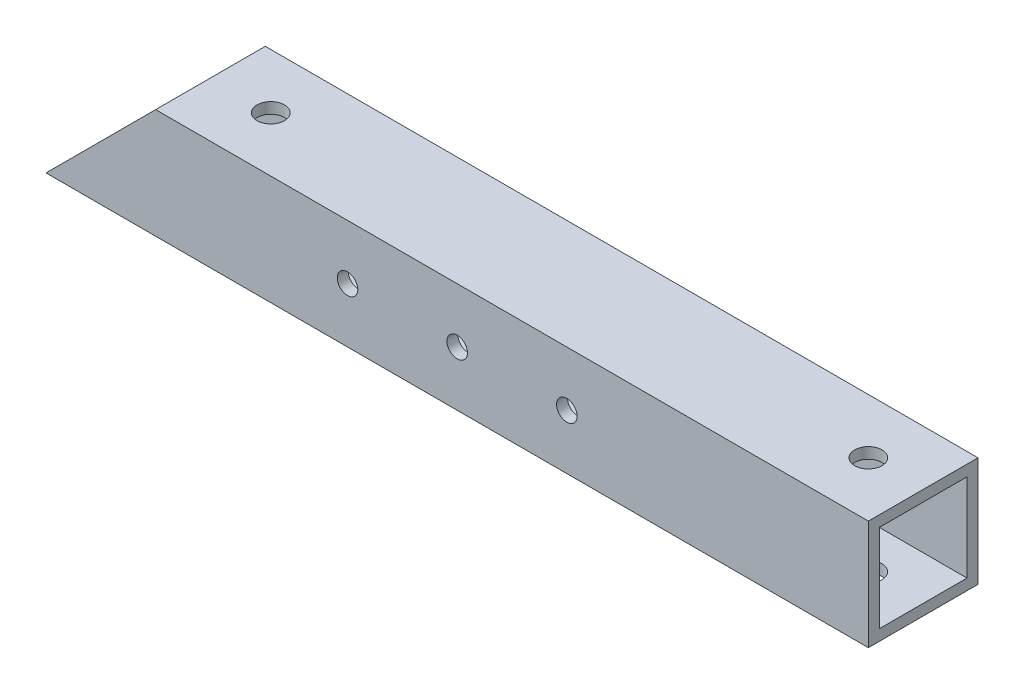
from build123d import *

# Parameters (mm, degrees)
SKETCH1_W           = 25.4
SKETCH1_H           = 25.4
SKETCH1_W_2         = 20.32
SKETCH1_H_2         = 20.32
BOSS_EXTRUDE1_DEPTH = 190.5
CUT_EXTRUDE1_DEPTH  = 193.605036279
SKETCH3_R           = 3.175
CUT_EXTRUDE2_DEPTH  = 193.605036279
SKETCH4_R           = 2.38125
CUT_EXTRUDE3_DEPTH  = 193.605036279


with BuildPart() as part:
    # Sketch1 → Boss-Extrude1 (new body)
    with BuildSketch(Plane(origin=(0, 0, 0), x_dir=(0, 0, -1), z_dir=(1, 0, 0))):
        Rectangle(SKETCH1_W, SKETCH1_H)
        Rectangle(SKETCH1_W_2, SKETCH1_H_2, mode=Mode.SUBTRACT)
    extrude(amount=BOSS_EXTRUDE1_DEPTH)

    # Sketch2 → Cut-Extrude1 (cut, through all)
    with BuildSketch(Plane.XY.offset(12.7)):
        Polygon((0, -12.7), (25.4, 12.7), (0, 12.7), align=None)
    extrude(amount=-CUT_EXTRUDE1_DEPTH, mode=Mode.SUBTRACT)

    # Sketch3 → Cut-Extrude2 (cut, through all)
    with BuildSketch(Plane(origin=(0, 12.7, 0), x_dir=(1, 0, 0), z_dir=(0, 1, 0))):
        with Locations(Location((177.8, 0, 0), (0, 0, 270))):
            Circle(SKETCH3_R)
        with Locations(Location((39.37, 0, 0), (0, 0, 270))):
            Circle(SKETCH3_R)
    extrude(amount=-CUT_EXTRUDE2_DEPTH, mode=Mode.SUBTRACT)

    # Sketch4 → Cut-Extrude3 (cut, through all)
    with BuildSketch(Plane.XY.offset(12.7)):
        with Locations((95.25, 0)):
            Circle(SKETCH4_R)
        with Locations((120.65, 0)):
            Circle(SKETCH4_R)
        with Locations((69.85, 0)):
            Circle(SKETCH4_R)
    extrude(amount=-CUT_EXTRUDE3_DEPTH, mode=Mode.SUBTRACT)


solid = part.part
